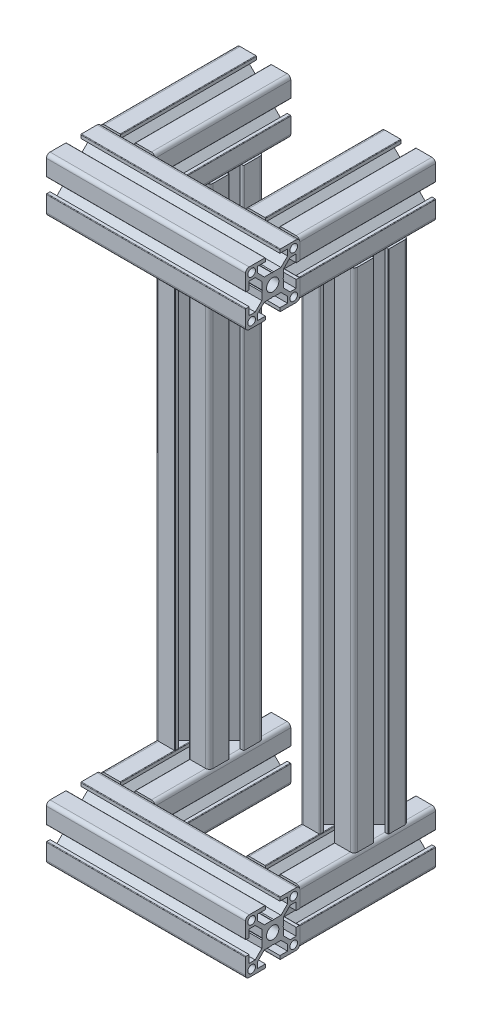
from build123d import *

# Parameters (mm, degrees)
C_PROGRAM_FILES_SOLIDWORKS_CORP_SOLIDWOR_DEPTH      = 95
C_PROGRAM_FILES_SOLIDWORKS_CORP_SOLIDWOR_DEPTH_BACK = 15
SKETCH_11_R                                         = 2.1
SKETCH_11_R_2                                       = 3.4
SKETCH_11_ON_SEGMENT_2_R                            = 2.1
SKETCH_11_ON_SEGMENT_2_R_2                          = 3.4
C_PROGRAM_FILES_SOLIDWORKS_CORP_SOLI_2_DEPTH        = 110
SKETCH_11_ON_SEGMENT_3_R                            = 2.1
SKETCH_11_ON_SEGMENT_3_R_2                          = 3.4
C_PROGRAM_FILES_SOLIDWORKS_CORP_SOLI_3_DEPTH        = 91
SKETCH_11_ON_SEGMENT_4_R                            = 2.1
SKETCH_11_ON_SEGMENT_4_R_2                          = 3.4
C_PROGRAM_FILES_SOLIDWORKS_CORP_SOLI_4_DEPTH        = 91
SKETCH_11_ON_SEGMENT_5_R                            = 2.1
SKETCH_11_ON_SEGMENT_5_R_2                          = 3.4
C_PROGRAM_FILES_SOLIDWORKS_CORP_SOLI_5_DEPTH        = 91
SKETCH_11_ON_SEGMENT_6_R                            = 2.1
SKETCH_11_ON_SEGMENT_6_R_2                          = 3.4
C_PROGRAM_FILES_SOLIDWORKS_CORP_SOLI_6_DEPTH        = 91
SKETCH_11_ON_SEGMENT_7_R                            = 2.1
SKETCH_11_ON_SEGMENT_7_R_2                          = 3.4
C_PROGRAM_FILES_SOLIDWORKS_CORP_SOLI_7_DEPTH        = 312
SKETCH_11_ON_SEGMENT_8_R                            = 2.1
SKETCH_11_ON_SEGMENT_8_R_2                          = 3.4
C_PROGRAM_FILES_SOLIDWORKS_CORP_SOLI_9_DEPTH        = 312


with BuildPart() as part:
    # 草图11 → C_PROGRAM FILES_SOLIDWORKS CORP_SOLIDWOR (new, two sides: drawn at the far end of the back side and taken through both)
    with BuildSketch(Plane(origin=(-80, 0, 90), x_dir=(0, 0, -1), z_dir=(1, 0, 0)).offset(-C_PROGRAM_FILES_SOLIDWORKS_CORP_SOLIDWOR_DEPTH_BACK)):
        with BuildLine():
            Line((-14.7, 4), (-13, 4))
            Line((-13, 4), (-13, 8.25))
            Line((-13, 8.25), (-9.664213562, 8.25))
            Line((-9.664213562, 8.25), (-6, 4.585786438))
            Line((-6, 4.585786438), (-6, 0.519615242))
            Line((-6, 0.519615242), (-5.7, 0))
            Line((-5.7, 0), (-6, -0.519615242))
            Line((-6, -0.519615242), (-6, -4.585786438))
            Line((-6, -4.585786438), (-9.664213562, -8.25))
            Line((-9.664213562, -8.25), (-13, -8.25))
            Line((-13, -8.25), (-13, -4))
            Line((-13, -4), (-14.7, -4))
            ThreePointArc((-14.7, -4), (-14.912132034, -4.087867966), (-15, -4.3))
            Line((-15, -4.3), (-15, -13))
            ThreePointArc((-15, -13), (-14.414213562, -14.414213562), (-13, -15))
            Line((-13, -15), (-4.3, -15))
            ThreePointArc((-4.3, -15), (-4.087867966, -14.912132034), (-4, -14.7))
            Line((-4, -14.7), (-4, -13))
            Line((-4, -13), (-8.25, -13))
            Line((-8.25, -13), (-8.25, -9.664213562))
            Line((-8.25, -9.664213562), (-4.585786438, -6))
            Line((-4.585786438, -6), (-0.519615242, -6))
            Line((-0.519615242, -6), (0, -5.7))
            Line((0, -5.7), (0.519615242, -6))
            Line((0.519615242, -6), (4.585786438, -6))
            Line((4.585786438, -6), (8.25, -9.664213562))
            Line((8.25, -9.664213562), (8.25, -13))
            Line((8.25, -13), (4, -13))
            Line((4, -13), (4, -14.7))
            ThreePointArc((4, -14.7), (4.087867966, -14.912132034), (4.3, -15))
            Line((4.3, -15), (13, -15))
            ThreePointArc((13, -15), (14.414213562, -14.414213562), (15, -13))
            Line((15, -13), (15, -4.3))
            ThreePointArc((15, -4.3), (14.912132034, -4.087867966), (14.7, -4))
            Line((14.7, -4), (13, -4))
            Line((13, -4), (13, -8.25))
            Line((13, -8.25), (9.664213562, -8.25))
            Line((9.664213562, -8.25), (6, -4.585786438))
            Line((6, -4.585786438), (6, -0.519615242))
            Line((6, -0.519615242), (5.7, 0))
            Line((5.7, 0), (6, 0.519615242))
            Line((6, 0.519615242), (6, 4.585786438))
            Line((6, 4.585786438), (9.664213562, 8.25))
            Line((9.664213562, 8.25), (13, 8.25))
            Line((13, 8.25), (13, 4))
            Line((13, 4), (14.7, 4))
            ThreePointArc((14.7, 4), (14.912132034, 4.087867966), (15, 4.3))
            Line((15, 4.3), (15, 13))
            ThreePointArc((15, 13), (14.414213562, 14.414213562), (13, 15))
            Line((13, 15), (4.3, 15))
            ThreePointArc((4.3, 15), (4.087867966, 14.912132034), (4, 14.7))
            Line((4, 14.7), (4, 13))
            Line((4, 13), (8.25, 13))
            Line((8.25, 13), (8.25, 9.664213562))
            Line((8.25, 9.664213562), (4.585786438, 6))
            Line((4.585786438, 6), (0.519615242, 6))
            Line((0.519615242, 6), (0, 5.7))
            Line((0, 5.7), (-0.519615242, 6))
            Line((-0.519615242, 6), (-4.585786438, 6))
            Line((-4.585786438, 6), (-8.25, 9.664213562))
            Line((-8.25, 9.664213562), (-8.25, 13))
            Line((-8.25, 13), (-4, 13))
            Line((-4, 13), (-4, 14.7))
            ThreePointArc((-4, 14.7), (-4.087867966, 14.912132034), (-4.3, 15))
            Line((-4.3, 15), (-13, 15))
            ThreePointArc((-13, 15), (-14.414213562, 14.414213562), (-15, 13))
            Line((-15, 13), (-15, 4.3))
            ThreePointArc((-15, 4.3), (-14.912132034, 4.087867966), (-14.7, 4))
        make_face()
        with Locations((11.625, 11.625)):
            Circle(SKETCH_11_R, mode=Mode.SUBTRACT)
        with Locations((11.625, -11.625)):
            Circle(SKETCH_11_R, mode=Mode.SUBTRACT)
        Circle(SKETCH_11_R_2, mode=Mode.SUBTRACT)
        with Locations((-11.625, -11.625)):
            Circle(SKETCH_11_R, mode=Mode.SUBTRACT)
        with Locations((-11.625, 11.625)):
            Circle(SKETCH_11_R, mode=Mode.SUBTRACT)
    extrude(amount=C_PROGRAM_FILES_SOLIDWORKS_CORP_SOLIDWOR_DEPTH + C_PROGRAM_FILES_SOLIDWORKS_CORP_SOLIDWOR_DEPTH_BACK)


with BuildPart() as body_2:
    # 草图11 on segment 2 (carried to segment 2) → C_PROGRAM FILES_SOLIDWORKS CORP_SOLI 2 (new body)
    with BuildSketch(Plane(origin=(-95, -310, 90), x_dir=(0, 0, -1), z_dir=(1, 0, 0))):
        with BuildLine():
            Line((-14.7, 4), (-13, 4))
            Line((-13, 4), (-13, 8.25))
            Line((-13, 8.25), (-9.664213562, 8.25))
            Line((-9.664213562, 8.25), (-6, 4.585786438))
            Line((-6, 4.585786438), (-6, 0.519615242))
            Line((-6, 0.519615242), (-5.7, 0))
            Line((-5.7, 0), (-6, -0.519615242))
            Line((-6, -0.519615242), (-6, -4.585786438))
            Line((-6, -4.585786438), (-9.664213562, -8.25))
            Line((-9.664213562, -8.25), (-13, -8.25))
            Line((-13, -8.25), (-13, -4))
            Line((-13, -4), (-14.7, -4))
            ThreePointArc((-14.7, -4), (-14.912132034, -4.087867966), (-15, -4.3))
            Line((-15, -4.3), (-15, -13))
            ThreePointArc((-15, -13), (-14.414213562, -14.414213562), (-13, -15))
            Line((-13, -15), (-4.3, -15))
            ThreePointArc((-4.3, -15), (-4.087867966, -14.912132034), (-4, -14.7))
            Line((-4, -14.7), (-4, -13))
            Line((-4, -13), (-8.25, -13))
            Line((-8.25, -13), (-8.25, -9.664213562))
            Line((-8.25, -9.664213562), (-4.585786438, -6))
            Line((-4.585786438, -6), (-0.519615242, -6))
            Line((-0.519615242, -6), (0, -5.7))
            Line((0, -5.7), (0.519615242, -6))
            Line((0.519615242, -6), (4.585786438, -6))
            Line((4.585786438, -6), (8.25, -9.664213562))
            Line((8.25, -9.664213562), (8.25, -13))
            Line((8.25, -13), (4, -13))
            Line((4, -13), (4, -14.7))
            ThreePointArc((4, -14.7), (4.087867966, -14.912132034), (4.3, -15))
            Line((4.3, -15), (13, -15))
            ThreePointArc((13, -15), (14.414213562, -14.414213562), (15, -13))
            Line((15, -13), (15, -4.3))
            ThreePointArc((15, -4.3), (14.912132034, -4.087867966), (14.7, -4))
            Line((14.7, -4), (13, -4))
            Line((13, -4), (13, -8.25))
            Line((13, -8.25), (9.664213562, -8.25))
            Line((9.664213562, -8.25), (6, -4.585786438))
            Line((6, -4.585786438), (6, -0.519615242))
            Line((6, -0.519615242), (5.7, 0))
            Line((5.7, 0), (6, 0.519615242))
            Line((6, 0.519615242), (6, 4.585786438))
            Line((6, 4.585786438), (9.664213562, 8.25))
            Line((9.664213562, 8.25), (13, 8.25))
            Line((13, 8.25), (13, 4))
            Line((13, 4), (14.7, 4))
            ThreePointArc((14.7, 4), (14.912132034, 4.087867966), (15, 4.3))
            Line((15, 4.3), (15, 13))
            ThreePointArc((15, 13), (14.414213562, 14.414213562), (13, 15))
            Line((13, 15), (4.3, 15))
            ThreePointArc((4.3, 15), (4.087867966, 14.912132034), (4, 14.7))
            Line((4, 14.7), (4, 13))
            Line((4, 13), (8.25, 13))
            Line((8.25, 13), (8.25, 9.664213562))
            Line((8.25, 9.664213562), (4.585786438, 6))
            Line((4.585786438, 6), (0.519615242, 6))
            Line((0.519615242, 6), (0, 5.7))
            Line((0, 5.7), (-0.519615242, 6))
            Line((-0.519615242, 6), (-4.585786438, 6))
            Line((-4.585786438, 6), (-8.25, 9.664213562))
            Line((-8.25, 9.664213562), (-8.25, 13))
            Line((-8.25, 13), (-4, 13))
            Line((-4, 13), (-4, 14.7))
            ThreePointArc((-4, 14.7), (-4.087867966, 14.912132034), (-4.3, 15))
            Line((-4.3, 15), (-13, 15))
            ThreePointArc((-13, 15), (-14.414213562, 14.414213562), (-15, 13))
            Line((-15, 13), (-15, 4.3))
            ThreePointArc((-15, 4.3), (-14.912132034, 4.087867966), (-14.7, 4))
        make_face()
        with Locations((11.625, 11.625)):
            Circle(SKETCH_11_ON_SEGMENT_2_R, mode=Mode.SUBTRACT)
        with Locations((11.625, -11.625)):
            Circle(SKETCH_11_ON_SEGMENT_2_R, mode=Mode.SUBTRACT)
        Circle(SKETCH_11_ON_SEGMENT_2_R_2, mode=Mode.SUBTRACT)
        with Locations((-11.625, -11.625)):
            Circle(SKETCH_11_ON_SEGMENT_2_R, mode=Mode.SUBTRACT)
        with Locations((-11.625, 11.625)):
            Circle(SKETCH_11_ON_SEGMENT_2_R, mode=Mode.SUBTRACT)
    extrude(amount=C_PROGRAM_FILES_SOLIDWORKS_CORP_SOLI_2_DEPTH)


with BuildPart() as body_3:
    # 草图11 on segment 3 (carried to segment 3) → C_PROGRAM FILES_SOLIDWORKS CORP_SOLI 3 (new body)
    with BuildSketch(Plane(origin=(0, 0, 91), x_dir=(-1, 0, 0), z_dir=(0, 0, -1))):
        with BuildLine():
            Line((-14.7, 4), (-13, 4))
            Line((-13, 4), (-13, 8.25))
            Line((-13, 8.25), (-9.664213562, 8.25))
            Line((-9.664213562, 8.25), (-6, 4.585786438))
            Line((-6, 4.585786438), (-6, 0.519615242))
            Line((-6, 0.519615242), (-5.7, 0))
            Line((-5.7, 0), (-6, -0.519615242))
            Line((-6, -0.519615242), (-6, -4.585786438))
            Line((-6, -4.585786438), (-9.664213562, -8.25))
            Line((-9.664213562, -8.25), (-13, -8.25))
            Line((-13, -8.25), (-13, -4))
            Line((-13, -4), (-14.7, -4))
            ThreePointArc((-14.7, -4), (-14.912132034, -4.087867966), (-15, -4.3))
            Line((-15, -4.3), (-15, -13))
            ThreePointArc((-15, -13), (-14.414213562, -14.414213562), (-13, -15))
            Line((-13, -15), (-4.3, -15))
            ThreePointArc((-4.3, -15), (-4.087867966, -14.912132034), (-4, -14.7))
            Line((-4, -14.7), (-4, -13))
            Line((-4, -13), (-8.25, -13))
            Line((-8.25, -13), (-8.25, -9.664213562))
            Line((-8.25, -9.664213562), (-4.585786438, -6))
            Line((-4.585786438, -6), (-0.519615242, -6))
            Line((-0.519615242, -6), (0, -5.7))
            Line((0, -5.7), (0.519615242, -6))
            Line((0.519615242, -6), (4.585786438, -6))
            Line((4.585786438, -6), (8.25, -9.664213562))
            Line((8.25, -9.664213562), (8.25, -13))
            Line((8.25, -13), (4, -13))
            Line((4, -13), (4, -14.7))
            ThreePointArc((4, -14.7), (4.087867966, -14.912132034), (4.3, -15))
            Line((4.3, -15), (13, -15))
            ThreePointArc((13, -15), (14.414213562, -14.414213562), (15, -13))
            Line((15, -13), (15, -4.3))
            ThreePointArc((15, -4.3), (14.912132034, -4.087867966), (14.7, -4))
            Line((14.7, -4), (13, -4))
            Line((13, -4), (13, -8.25))
            Line((13, -8.25), (9.664213562, -8.25))
            Line((9.664213562, -8.25), (6, -4.585786438))
            Line((6, -4.585786438), (6, -0.519615242))
            Line((6, -0.519615242), (5.7, 0))
            Line((5.7, 0), (6, 0.519615242))
            Line((6, 0.519615242), (6, 4.585786438))
            Line((6, 4.585786438), (9.664213562, 8.25))
            Line((9.664213562, 8.25), (13, 8.25))
            Line((13, 8.25), (13, 4))
            Line((13, 4), (14.7, 4))
            ThreePointArc((14.7, 4), (14.912132034, 4.087867966), (15, 4.3))
            Line((15, 4.3), (15, 13))
            ThreePointArc((15, 13), (14.414213562, 14.414213562), (13, 15))
            Line((13, 15), (4.3, 15))
            ThreePointArc((4.3, 15), (4.087867966, 14.912132034), (4, 14.7))
            Line((4, 14.7), (4, 13))
            Line((4, 13), (8.25, 13))
            Line((8.25, 13), (8.25, 9.664213562))
            Line((8.25, 9.664213562), (4.585786438, 6))
            Line((4.585786438, 6), (0.519615242, 6))
            Line((0.519615242, 6), (0, 5.7))
            Line((0, 5.7), (-0.519615242, 6))
            Line((-0.519615242, 6), (-4.585786438, 6))
            Line((-4.585786438, 6), (-8.25, 9.664213562))
            Line((-8.25, 9.664213562), (-8.25, 13))
            Line((-8.25, 13), (-4, 13))
            Line((-4, 13), (-4, 14.7))
            ThreePointArc((-4, 14.7), (-4.087867966, 14.912132034), (-4.3, 15))
            Line((-4.3, 15), (-13, 15))
            ThreePointArc((-13, 15), (-14.414213562, 14.414213562), (-15, 13))
            Line((-15, 13), (-15, 4.3))
            ThreePointArc((-15, 4.3), (-14.912132034, 4.087867966), (-14.7, 4))
        make_face()
        with Locations((11.625, 11.625)):
            Circle(SKETCH_11_ON_SEGMENT_3_R, mode=Mode.SUBTRACT)
        with Locations((11.625, -11.625)):
            Circle(SKETCH_11_ON_SEGMENT_3_R, mode=Mode.SUBTRACT)
        Circle(SKETCH_11_ON_SEGMENT_3_R_2, mode=Mode.SUBTRACT)
        with Locations((-11.625, -11.625)):
            Circle(SKETCH_11_ON_SEGMENT_3_R, mode=Mode.SUBTRACT)
        with Locations((-11.625, 11.625)):
            Circle(SKETCH_11_ON_SEGMENT_3_R, mode=Mode.SUBTRACT)
    extrude(amount=C_PROGRAM_FILES_SOLIDWORKS_CORP_SOLI_3_DEPTH)

    # C_PROGRAM FILES_SOLIDWORKS CORP_SOLI 3 e
    split(bisect_by=Plane.YX.offset(-75), keep=Keep.TOP)


with BuildPart() as body_4:
    # 草图11 on segment 4 (carried to segment 4) → C_PROGRAM FILES_SOLIDWORKS CORP_SOLI 4 (new body)
    with BuildSketch(Plane(origin=(-80, 0, 0), x_dir=(1, 0, 0), z_dir=(0, 0, 1))):
        with BuildLine():
            Line((-14.7, 4), (-13, 4))
            Line((-13, 4), (-13, 8.25))
            Line((-13, 8.25), (-9.664213562, 8.25))
            Line((-9.664213562, 8.25), (-6, 4.585786438))
            Line((-6, 4.585786438), (-6, 0.519615242))
            Line((-6, 0.519615242), (-5.7, 0))
            Line((-5.7, 0), (-6, -0.519615242))
            Line((-6, -0.519615242), (-6, -4.585786438))
            Line((-6, -4.585786438), (-9.664213562, -8.25))
            Line((-9.664213562, -8.25), (-13, -8.25))
            Line((-13, -8.25), (-13, -4))
            Line((-13, -4), (-14.7, -4))
            ThreePointArc((-14.7, -4), (-14.912132034, -4.087867966), (-15, -4.3))
            Line((-15, -4.3), (-15, -13))
            ThreePointArc((-15, -13), (-14.414213562, -14.414213562), (-13, -15))
            Line((-13, -15), (-4.3, -15))
            ThreePointArc((-4.3, -15), (-4.087867966, -14.912132034), (-4, -14.7))
            Line((-4, -14.7), (-4, -13))
            Line((-4, -13), (-8.25, -13))
            Line((-8.25, -13), (-8.25, -9.664213562))
            Line((-8.25, -9.664213562), (-4.585786438, -6))
            Line((-4.585786438, -6), (-0.519615242, -6))
            Line((-0.519615242, -6), (0, -5.7))
            Line((0, -5.7), (0.519615242, -6))
            Line((0.519615242, -6), (4.585786438, -6))
            Line((4.585786438, -6), (8.25, -9.664213562))
            Line((8.25, -9.664213562), (8.25, -13))
            Line((8.25, -13), (4, -13))
            Line((4, -13), (4, -14.7))
            ThreePointArc((4, -14.7), (4.087867966, -14.912132034), (4.3, -15))
            Line((4.3, -15), (13, -15))
            ThreePointArc((13, -15), (14.414213562, -14.414213562), (15, -13))
            Line((15, -13), (15, -4.3))
            ThreePointArc((15, -4.3), (14.912132034, -4.087867966), (14.7, -4))
            Line((14.7, -4), (13, -4))
            Line((13, -4), (13, -8.25))
            Line((13, -8.25), (9.664213562, -8.25))
            Line((9.664213562, -8.25), (6, -4.585786438))
            Line((6, -4.585786438), (6, -0.519615242))
            Line((6, -0.519615242), (5.7, 0))
            Line((5.7, 0), (6, 0.519615242))
            Line((6, 0.519615242), (6, 4.585786438))
            Line((6, 4.585786438), (9.664213562, 8.25))
            Line((9.664213562, 8.25), (13, 8.25))
            Line((13, 8.25), (13, 4))
            Line((13, 4), (14.7, 4))
            ThreePointArc((14.7, 4), (14.912132034, 4.087867966), (15, 4.3))
            Line((15, 4.3), (15, 13))
            ThreePointArc((15, 13), (14.414213562, 14.414213562), (13, 15))
            Line((13, 15), (4.3, 15))
            ThreePointArc((4.3, 15), (4.087867966, 14.912132034), (4, 14.7))
            Line((4, 14.7), (4, 13))
            Line((4, 13), (8.25, 13))
            Line((8.25, 13), (8.25, 9.664213562))
            Line((8.25, 9.664213562), (4.585786438, 6))
            Line((4.585786438, 6), (0.519615242, 6))
            Line((0.519615242, 6), (0, 5.7))
            Line((0, 5.7), (-0.519615242, 6))
            Line((-0.519615242, 6), (-4.585786438, 6))
            Line((-4.585786438, 6), (-8.25, 9.664213562))
            Line((-8.25, 9.664213562), (-8.25, 13))
            Line((-8.25, 13), (-4, 13))
            Line((-4, 13), (-4, 14.7))
            ThreePointArc((-4, 14.7), (-4.087867966, 14.912132034), (-4.3, 15))
            Line((-4.3, 15), (-13, 15))
            ThreePointArc((-13, 15), (-14.414213562, 14.414213562), (-15, 13))
            Line((-15, 13), (-15, 4.3))
            ThreePointArc((-15, 4.3), (-14.912132034, 4.087867966), (-14.7, 4))
        make_face()
        with Locations((11.625, 11.625)):
            Circle(SKETCH_11_ON_SEGMENT_4_R, mode=Mode.SUBTRACT)
        with Locations((11.625, -11.625)):
            Circle(SKETCH_11_ON_SEGMENT_4_R, mode=Mode.SUBTRACT)
        Circle(SKETCH_11_ON_SEGMENT_4_R_2, mode=Mode.SUBTRACT)
        with Locations((-11.625, -11.625)):
            Circle(SKETCH_11_ON_SEGMENT_4_R, mode=Mode.SUBTRACT)
        with Locations((-11.625, 11.625)):
            Circle(SKETCH_11_ON_SEGMENT_4_R, mode=Mode.SUBTRACT)
    extrude(amount=C_PROGRAM_FILES_SOLIDWORKS_CORP_SOLI_4_DEPTH)

    # C_PROGRAM FILES_SOLIDWORKS CORP_SOLI 4 e
    split(bisect_by=Plane(origin=(-80, 0, 75), x_dir=(0, 1, 0), z_dir=(0, 0, -1)), keep=Keep.TOP)


with BuildPart() as body_5:
    # 草图11 on segment 5 (carried to segment 5) → C_PROGRAM FILES_SOLIDWORKS CORP_SOLI 5 (new body)
    with BuildSketch(Plane(origin=(-80, -310, 91), x_dir=(-1, 0, 0), z_dir=(0, 0, -1))):
        with BuildLine():
            Line((-14.7, 4), (-13, 4))
            Line((-13, 4), (-13, 8.25))
            Line((-13, 8.25), (-9.664213562, 8.25))
            Line((-9.664213562, 8.25), (-6, 4.585786438))
            Line((-6, 4.585786438), (-6, 0.519615242))
            Line((-6, 0.519615242), (-5.7, 0))
            Line((-5.7, 0), (-6, -0.519615242))
            Line((-6, -0.519615242), (-6, -4.585786438))
            Line((-6, -4.585786438), (-9.664213562, -8.25))
            Line((-9.664213562, -8.25), (-13, -8.25))
            Line((-13, -8.25), (-13, -4))
            Line((-13, -4), (-14.7, -4))
            ThreePointArc((-14.7, -4), (-14.912132034, -4.087867966), (-15, -4.3))
            Line((-15, -4.3), (-15, -13))
            ThreePointArc((-15, -13), (-14.414213562, -14.414213562), (-13, -15))
            Line((-13, -15), (-4.3, -15))
            ThreePointArc((-4.3, -15), (-4.087867966, -14.912132034), (-4, -14.7))
            Line((-4, -14.7), (-4, -13))
            Line((-4, -13), (-8.25, -13))
            Line((-8.25, -13), (-8.25, -9.664213562))
            Line((-8.25, -9.664213562), (-4.585786438, -6))
            Line((-4.585786438, -6), (-0.519615242, -6))
            Line((-0.519615242, -6), (0, -5.7))
            Line((0, -5.7), (0.519615242, -6))
            Line((0.519615242, -6), (4.585786438, -6))
            Line((4.585786438, -6), (8.25, -9.664213562))
            Line((8.25, -9.664213562), (8.25, -13))
            Line((8.25, -13), (4, -13))
            Line((4, -13), (4, -14.7))
            ThreePointArc((4, -14.7), (4.087867966, -14.912132034), (4.3, -15))
            Line((4.3, -15), (13, -15))
            ThreePointArc((13, -15), (14.414213562, -14.414213562), (15, -13))
            Line((15, -13), (15, -4.3))
            ThreePointArc((15, -4.3), (14.912132034, -4.087867966), (14.7, -4))
            Line((14.7, -4), (13, -4))
            Line((13, -4), (13, -8.25))
            Line((13, -8.25), (9.664213562, -8.25))
            Line((9.664213562, -8.25), (6, -4.585786438))
            Line((6, -4.585786438), (6, -0.519615242))
            Line((6, -0.519615242), (5.7, 0))
            Line((5.7, 0), (6, 0.519615242))
            Line((6, 0.519615242), (6, 4.585786438))
            Line((6, 4.585786438), (9.664213562, 8.25))
            Line((9.664213562, 8.25), (13, 8.25))
            Line((13, 8.25), (13, 4))
            Line((13, 4), (14.7, 4))
            ThreePointArc((14.7, 4), (14.912132034, 4.087867966), (15, 4.3))
            Line((15, 4.3), (15, 13))
            ThreePointArc((15, 13), (14.414213562, 14.414213562), (13, 15))
            Line((13, 15), (4.3, 15))
            ThreePointArc((4.3, 15), (4.087867966, 14.912132034), (4, 14.7))
            Line((4, 14.7), (4, 13))
            Line((4, 13), (8.25, 13))
            Line((8.25, 13), (8.25, 9.664213562))
            Line((8.25, 9.664213562), (4.585786438, 6))
            Line((4.585786438, 6), (0.519615242, 6))
            Line((0.519615242, 6), (0, 5.7))
            Line((0, 5.7), (-0.519615242, 6))
            Line((-0.519615242, 6), (-4.585786438, 6))
            Line((-4.585786438, 6), (-8.25, 9.664213562))
            Line((-8.25, 9.664213562), (-8.25, 13))
            Line((-8.25, 13), (-4, 13))
            Line((-4, 13), (-4, 14.7))
            ThreePointArc((-4, 14.7), (-4.087867966, 14.912132034), (-4.3, 15))
            Line((-4.3, 15), (-13, 15))
            ThreePointArc((-13, 15), (-14.414213562, 14.414213562), (-15, 13))
            Line((-15, 13), (-15, 4.3))
            ThreePointArc((-15, 4.3), (-14.912132034, 4.087867966), (-14.7, 4))
        make_face()
        with Locations((11.625, 11.625)):
            Circle(SKETCH_11_ON_SEGMENT_5_R, mode=Mode.SUBTRACT)
        with Locations((11.625, -11.625)):
            Circle(SKETCH_11_ON_SEGMENT_5_R, mode=Mode.SUBTRACT)
        Circle(SKETCH_11_ON_SEGMENT_5_R_2, mode=Mode.SUBTRACT)
        with Locations((-11.625, -11.625)):
            Circle(SKETCH_11_ON_SEGMENT_5_R, mode=Mode.SUBTRACT)
        with Locations((-11.625, 11.625)):
            Circle(SKETCH_11_ON_SEGMENT_5_R, mode=Mode.SUBTRACT)
    extrude(amount=C_PROGRAM_FILES_SOLIDWORKS_CORP_SOLI_5_DEPTH)

    # C_PROGRAM FILES_SOLIDWORKS CORP_SOLI 5 e
    split(bisect_by=Plane(origin=(-80, -310, 75), x_dir=(0, 1, 0), z_dir=(0, 0, -1)), keep=Keep.TOP)


with BuildPart() as body_6:
    # 草图11 on segment 6 (carried to segment 6) → C_PROGRAM FILES_SOLIDWORKS CORP_SOLI 6 (new body)
    with BuildSketch(Plane(origin=(0, -310, 0), x_dir=(1, 0, 0), z_dir=(0, 0, 1))):
        with BuildLine():
            Line((-14.7, 4), (-13, 4))
            Line((-13, 4), (-13, 8.25))
            Line((-13, 8.25), (-9.664213562, 8.25))
            Line((-9.664213562, 8.25), (-6, 4.585786438))
            Line((-6, 4.585786438), (-6, 0.519615242))
            Line((-6, 0.519615242), (-5.7, 0))
            Line((-5.7, 0), (-6, -0.519615242))
            Line((-6, -0.519615242), (-6, -4.585786438))
            Line((-6, -4.585786438), (-9.664213562, -8.25))
            Line((-9.664213562, -8.25), (-13, -8.25))
            Line((-13, -8.25), (-13, -4))
            Line((-13, -4), (-14.7, -4))
            ThreePointArc((-14.7, -4), (-14.912132034, -4.087867966), (-15, -4.3))
            Line((-15, -4.3), (-15, -13))
            ThreePointArc((-15, -13), (-14.414213562, -14.414213562), (-13, -15))
            Line((-13, -15), (-4.3, -15))
            ThreePointArc((-4.3, -15), (-4.087867966, -14.912132034), (-4, -14.7))
            Line((-4, -14.7), (-4, -13))
            Line((-4, -13), (-8.25, -13))
            Line((-8.25, -13), (-8.25, -9.664213562))
            Line((-8.25, -9.664213562), (-4.585786438, -6))
            Line((-4.585786438, -6), (-0.519615242, -6))
            Line((-0.519615242, -6), (0, -5.7))
            Line((0, -5.7), (0.519615242, -6))
            Line((0.519615242, -6), (4.585786438, -6))
            Line((4.585786438, -6), (8.25, -9.664213562))
            Line((8.25, -9.664213562), (8.25, -13))
            Line((8.25, -13), (4, -13))
            Line((4, -13), (4, -14.7))
            ThreePointArc((4, -14.7), (4.087867966, -14.912132034), (4.3, -15))
            Line((4.3, -15), (13, -15))
            ThreePointArc((13, -15), (14.414213562, -14.414213562), (15, -13))
            Line((15, -13), (15, -4.3))
            ThreePointArc((15, -4.3), (14.912132034, -4.087867966), (14.7, -4))
            Line((14.7, -4), (13, -4))
            Line((13, -4), (13, -8.25))
            Line((13, -8.25), (9.664213562, -8.25))
            Line((9.664213562, -8.25), (6, -4.585786438))
            Line((6, -4.585786438), (6, -0.519615242))
            Line((6, -0.519615242), (5.7, 0))
            Line((5.7, 0), (6, 0.519615242))
            Line((6, 0.519615242), (6, 4.585786438))
            Line((6, 4.585786438), (9.664213562, 8.25))
            Line((9.664213562, 8.25), (13, 8.25))
            Line((13, 8.25), (13, 4))
            Line((13, 4), (14.7, 4))
            ThreePointArc((14.7, 4), (14.912132034, 4.087867966), (15, 4.3))
            Line((15, 4.3), (15, 13))
            ThreePointArc((15, 13), (14.414213562, 14.414213562), (13, 15))
            Line((13, 15), (4.3, 15))
            ThreePointArc((4.3, 15), (4.087867966, 14.912132034), (4, 14.7))
            Line((4, 14.7), (4, 13))
            Line((4, 13), (8.25, 13))
            Line((8.25, 13), (8.25, 9.664213562))
            Line((8.25, 9.664213562), (4.585786438, 6))
            Line((4.585786438, 6), (0.519615242, 6))
            Line((0.519615242, 6), (0, 5.7))
            Line((0, 5.7), (-0.519615242, 6))
            Line((-0.519615242, 6), (-4.585786438, 6))
            Line((-4.585786438, 6), (-8.25, 9.664213562))
            Line((-8.25, 9.664213562), (-8.25, 13))
            Line((-8.25, 13), (-4, 13))
            Line((-4, 13), (-4, 14.7))
            ThreePointArc((-4, 14.7), (-4.087867966, 14.912132034), (-4.3, 15))
            Line((-4.3, 15), (-13, 15))
            ThreePointArc((-13, 15), (-14.414213562, 14.414213562), (-15, 13))
            Line((-15, 13), (-15, 4.3))
            ThreePointArc((-15, 4.3), (-14.912132034, 4.087867966), (-14.7, 4))
        make_face()
        with Locations((11.625, 11.625)):
            Circle(SKETCH_11_ON_SEGMENT_6_R, mode=Mode.SUBTRACT)
        with Locations((11.625, -11.625)):
            Circle(SKETCH_11_ON_SEGMENT_6_R, mode=Mode.SUBTRACT)
        Circle(SKETCH_11_ON_SEGMENT_6_R_2, mode=Mode.SUBTRACT)
        with Locations((-11.625, -11.625)):
            Circle(SKETCH_11_ON_SEGMENT_6_R, mode=Mode.SUBTRACT)
        with Locations((-11.625, 11.625)):
            Circle(SKETCH_11_ON_SEGMENT_6_R, mode=Mode.SUBTRACT)
    extrude(amount=C_PROGRAM_FILES_SOLIDWORKS_CORP_SOLI_6_DEPTH)

    # C_PROGRAM FILES_SOLIDWORKS CORP_SOLI 6 e
    split(bisect_by=Plane(origin=(0, -310, 75), x_dir=(0, 1, 0), z_dir=(0, 0, -1)), keep=Keep.TOP)


with BuildPart() as body_7:
    # 草图11 on segment 7 (carried to segment 7) → C_PROGRAM FILES_SOLIDWORKS CORP_SOLI 7 (new body)
    with BuildSketch(Plane(origin=(-80, -311, 30), x_dir=(0, 0, -1), z_dir=(0, 1, 0))):
        with BuildLine():
            Line((-14.7, 4), (-13, 4))
            Line((-13, 4), (-13, 8.25))
            Line((-13, 8.25), (-9.664213562, 8.25))
            Line((-9.664213562, 8.25), (-6, 4.585786438))
            Line((-6, 4.585786438), (-6, 0.519615242))
            Line((-6, 0.519615242), (-5.7, 0))
            Line((-5.7, 0), (-6, -0.519615242))
            Line((-6, -0.519615242), (-6, -4.585786438))
            Line((-6, -4.585786438), (-9.664213562, -8.25))
            Line((-9.664213562, -8.25), (-13, -8.25))
            Line((-13, -8.25), (-13, -4))
            Line((-13, -4), (-14.7, -4))
            ThreePointArc((-14.7, -4), (-14.912132034, -4.087867966), (-15, -4.3))
            Line((-15, -4.3), (-15, -13))
            ThreePointArc((-15, -13), (-14.414213562, -14.414213562), (-13, -15))
            Line((-13, -15), (-4.3, -15))
            ThreePointArc((-4.3, -15), (-4.087867966, -14.912132034), (-4, -14.7))
            Line((-4, -14.7), (-4, -13))
            Line((-4, -13), (-8.25, -13))
            Line((-8.25, -13), (-8.25, -9.664213562))
            Line((-8.25, -9.664213562), (-4.585786438, -6))
            Line((-4.585786438, -6), (-0.519615242, -6))
            Line((-0.519615242, -6), (0, -5.7))
            Line((0, -5.7), (0.519615242, -6))
            Line((0.519615242, -6), (4.585786438, -6))
            Line((4.585786438, -6), (8.25, -9.664213562))
            Line((8.25, -9.664213562), (8.25, -13))
            Line((8.25, -13), (4, -13))
            Line((4, -13), (4, -14.7))
            ThreePointArc((4, -14.7), (4.087867966, -14.912132034), (4.3, -15))
            Line((4.3, -15), (13, -15))
            ThreePointArc((13, -15), (14.414213562, -14.414213562), (15, -13))
            Line((15, -13), (15, -4.3))
            ThreePointArc((15, -4.3), (14.912132034, -4.087867966), (14.7, -4))
            Line((14.7, -4), (13, -4))
            Line((13, -4), (13, -8.25))
            Line((13, -8.25), (9.664213562, -8.25))
            Line((9.664213562, -8.25), (6, -4.585786438))
            Line((6, -4.585786438), (6, -0.519615242))
            Line((6, -0.519615242), (5.7, 0))
            Line((5.7, 0), (6, 0.519615242))
            Line((6, 0.519615242), (6, 4.585786438))
            Line((6, 4.585786438), (9.664213562, 8.25))
            Line((9.664213562, 8.25), (13, 8.25))
            Line((13, 8.25), (13, 4))
            Line((13, 4), (14.7, 4))
            ThreePointArc((14.7, 4), (14.912132034, 4.087867966), (15, 4.3))
            Line((15, 4.3), (15, 13))
            ThreePointArc((15, 13), (14.414213562, 14.414213562), (13, 15))
            Line((13, 15), (4.3, 15))
            ThreePointArc((4.3, 15), (4.087867966, 14.912132034), (4, 14.7))
            Line((4, 14.7), (4, 13))
            Line((4, 13), (8.25, 13))
            Line((8.25, 13), (8.25, 9.664213562))
            Line((8.25, 9.664213562), (4.585786438, 6))
            Line((4.585786438, 6), (0.519615242, 6))
            Line((0.519615242, 6), (0, 5.7))
            Line((0, 5.7), (-0.519615242, 6))
            Line((-0.519615242, 6), (-4.585786438, 6))
            Line((-4.585786438, 6), (-8.25, 9.664213562))
            Line((-8.25, 9.664213562), (-8.25, 13))
            Line((-8.25, 13), (-4, 13))
            Line((-4, 13), (-4, 14.7))
            ThreePointArc((-4, 14.7), (-4.087867966, 14.912132034), (-4.3, 15))
            Line((-4.3, 15), (-13, 15))
            ThreePointArc((-13, 15), (-14.414213562, 14.414213562), (-15, 13))
            Line((-15, 13), (-15, 4.3))
            ThreePointArc((-15, 4.3), (-14.912132034, 4.087867966), (-14.7, 4))
        make_face()
        with Locations((11.625, 11.625)):
            Circle(SKETCH_11_ON_SEGMENT_7_R, mode=Mode.SUBTRACT)
        with Locations((11.625, -11.625)):
            Circle(SKETCH_11_ON_SEGMENT_7_R, mode=Mode.SUBTRACT)
        Circle(SKETCH_11_ON_SEGMENT_7_R_2, mode=Mode.SUBTRACT)
        with Locations((-11.625, -11.625)):
            Circle(SKETCH_11_ON_SEGMENT_7_R, mode=Mode.SUBTRACT)
        with Locations((-11.625, 11.625)):
            Circle(SKETCH_11_ON_SEGMENT_7_R, mode=Mode.SUBTRACT)
    extrude(amount=C_PROGRAM_FILES_SOLIDWORKS_CORP_SOLI_7_DEPTH)

    # C_PROGRAM FILES_SOLIDWORKS CORP_SOLI 7 e
    split(bisect_by=Plane(origin=(-80, -15, 30), x_dir=(1, 0, 0), z_dir=(0, -1, 0)), keep=Keep.TOP)

    # C_PROGRAM FILES_SOLIDWORKS CORP_SOLI 8
    split(bisect_by=Plane(origin=(-80, -295, 30), x_dir=(-1, 0, 0), z_dir=(0, 1, 0)), keep=Keep.TOP)


with BuildPart() as body_8:
    # 草图11 on segment 8 (carried to segment 8) → C_PROGRAM FILES_SOLIDWORKS CORP_SOLI 9 (new body)
    with BuildSketch(Plane(origin=(0, -311, 30), x_dir=(0, 0, -1), z_dir=(0, 1, 0))):
        with BuildLine():
            Line((-14.7, 4), (-13, 4))
            Line((-13, 4), (-13, 8.25))
            Line((-13, 8.25), (-9.664213562, 8.25))
            Line((-9.664213562, 8.25), (-6, 4.585786438))
            Line((-6, 4.585786438), (-6, 0.519615242))
            Line((-6, 0.519615242), (-5.7, 0))
            Line((-5.7, 0), (-6, -0.519615242))
            Line((-6, -0.519615242), (-6, -4.585786438))
            Line((-6, -4.585786438), (-9.664213562, -8.25))
            Line((-9.664213562, -8.25), (-13, -8.25))
            Line((-13, -8.25), (-13, -4))
            Line((-13, -4), (-14.7, -4))
            ThreePointArc((-14.7, -4), (-14.912132034, -4.087867966), (-15, -4.3))
            Line((-15, -4.3), (-15, -13))
            ThreePointArc((-15, -13), (-14.414213562, -14.414213562), (-13, -15))
            Line((-13, -15), (-4.3, -15))
            ThreePointArc((-4.3, -15), (-4.087867966, -14.912132034), (-4, -14.7))
            Line((-4, -14.7), (-4, -13))
            Line((-4, -13), (-8.25, -13))
            Line((-8.25, -13), (-8.25, -9.664213562))
            Line((-8.25, -9.664213562), (-4.585786438, -6))
            Line((-4.585786438, -6), (-0.519615242, -6))
            Line((-0.519615242, -6), (0, -5.7))
            Line((0, -5.7), (0.519615242, -6))
            Line((0.519615242, -6), (4.585786438, -6))
            Line((4.585786438, -6), (8.25, -9.664213562))
            Line((8.25, -9.664213562), (8.25, -13))
            Line((8.25, -13), (4, -13))
            Line((4, -13), (4, -14.7))
            ThreePointArc((4, -14.7), (4.087867966, -14.912132034), (4.3, -15))
            Line((4.3, -15), (13, -15))
            ThreePointArc((13, -15), (14.414213562, -14.414213562), (15, -13))
            Line((15, -13), (15, -4.3))
            ThreePointArc((15, -4.3), (14.912132034, -4.087867966), (14.7, -4))
            Line((14.7, -4), (13, -4))
            Line((13, -4), (13, -8.25))
            Line((13, -8.25), (9.664213562, -8.25))
            Line((9.664213562, -8.25), (6, -4.585786438))
            Line((6, -4.585786438), (6, -0.519615242))
            Line((6, -0.519615242), (5.7, 0))
            Line((5.7, 0), (6, 0.519615242))
            Line((6, 0.519615242), (6, 4.585786438))
            Line((6, 4.585786438), (9.664213562, 8.25))
            Line((9.664213562, 8.25), (13, 8.25))
            Line((13, 8.25), (13, 4))
            Line((13, 4), (14.7, 4))
            ThreePointArc((14.7, 4), (14.912132034, 4.087867966), (15, 4.3))
            Line((15, 4.3), (15, 13))
            ThreePointArc((15, 13), (14.414213562, 14.414213562), (13, 15))
            Line((13, 15), (4.3, 15))
            ThreePointArc((4.3, 15), (4.087867966, 14.912132034), (4, 14.7))
            Line((4, 14.7), (4, 13))
            Line((4, 13), (8.25, 13))
            Line((8.25, 13), (8.25, 9.664213562))
            Line((8.25, 9.664213562), (4.585786438, 6))
            Line((4.585786438, 6), (0.519615242, 6))
            Line((0.519615242, 6), (0, 5.7))
            Line((0, 5.7), (-0.519615242, 6))
            Line((-0.519615242, 6), (-4.585786438, 6))
            Line((-4.585786438, 6), (-8.25, 9.664213562))
            Line((-8.25, 9.664213562), (-8.25, 13))
            Line((-8.25, 13), (-4, 13))
            Line((-4, 13), (-4, 14.7))
            ThreePointArc((-4, 14.7), (-4.087867966, 14.912132034), (-4.3, 15))
            Line((-4.3, 15), (-13, 15))
            ThreePointArc((-13, 15), (-14.414213562, 14.414213562), (-15, 13))
            Line((-15, 13), (-15, 4.3))
            ThreePointArc((-15, 4.3), (-14.912132034, 4.087867966), (-14.7, 4))
        make_face()
        with Locations((11.625, 11.625)):
            Circle(SKETCH_11_ON_SEGMENT_8_R, mode=Mode.SUBTRACT)
        with Locations((11.625, -11.625)):
            Circle(SKETCH_11_ON_SEGMENT_8_R, mode=Mode.SUBTRACT)
        Circle(SKETCH_11_ON_SEGMENT_8_R_2, mode=Mode.SUBTRACT)
        with Locations((-11.625, -11.625)):
            Circle(SKETCH_11_ON_SEGMENT_8_R, mode=Mode.SUBTRACT)
        with Locations((-11.625, 11.625)):
            Circle(SKETCH_11_ON_SEGMENT_8_R, mode=Mode.SUBTRACT)
    extrude(amount=C_PROGRAM_FILES_SOLIDWORKS_CORP_SOLI_9_DEPTH)

    # C_PROGRAM FILES_SOLIDWORKS CORP_SOLI 9 e
    split(bisect_by=Plane(origin=(0, -15, 30), x_dir=(1, 0, 0), z_dir=(0, -1, 0)), keep=Keep.TOP)

    # C_PROGRAM FILES_SOLIDWORKS CORP_SOLI 10
    split(bisect_by=Plane(origin=(0, -295, 30), x_dir=(-1, 0, 0), z_dir=(0, 1, 0)), keep=Keep.TOP)


solid = Compound([part.part, body_2.part, body_3.part, body_4.part, body_5.part, body_6.part, body_7.part, body_8.part])
